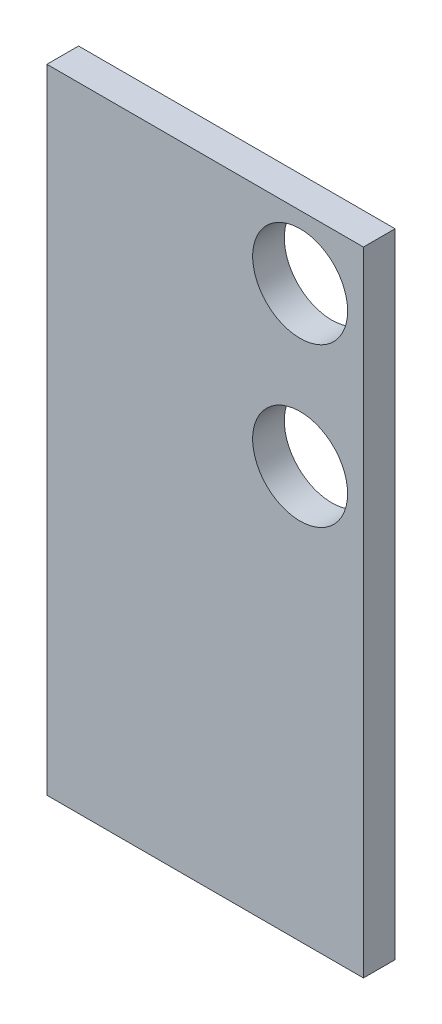
from build123d import *

# Parameters (mm, degrees)
SKETCH_1_W      = 10
SKETCH_1_H      = 20
SKETCH_1_R      = 1.5
EXTRUDE_1_DEPTH = 1


with BuildPart() as part:
    # 草图1 → 凸台-拉伸1 (new body)
    with BuildSketch(Plane.XY):
        with Locations((2.094339623, 0)):
            Rectangle(SKETCH_1_W, SKETCH_1_H)
        with Locations((5.094339623, 8)):
            Circle(SKETCH_1_R, mode=Mode.SUBTRACT)
        with Locations((5.094339623, 3)):
            Circle(SKETCH_1_R, mode=Mode.SUBTRACT)
    extrude(amount=EXTRUDE_1_DEPTH)


solid = part.part
